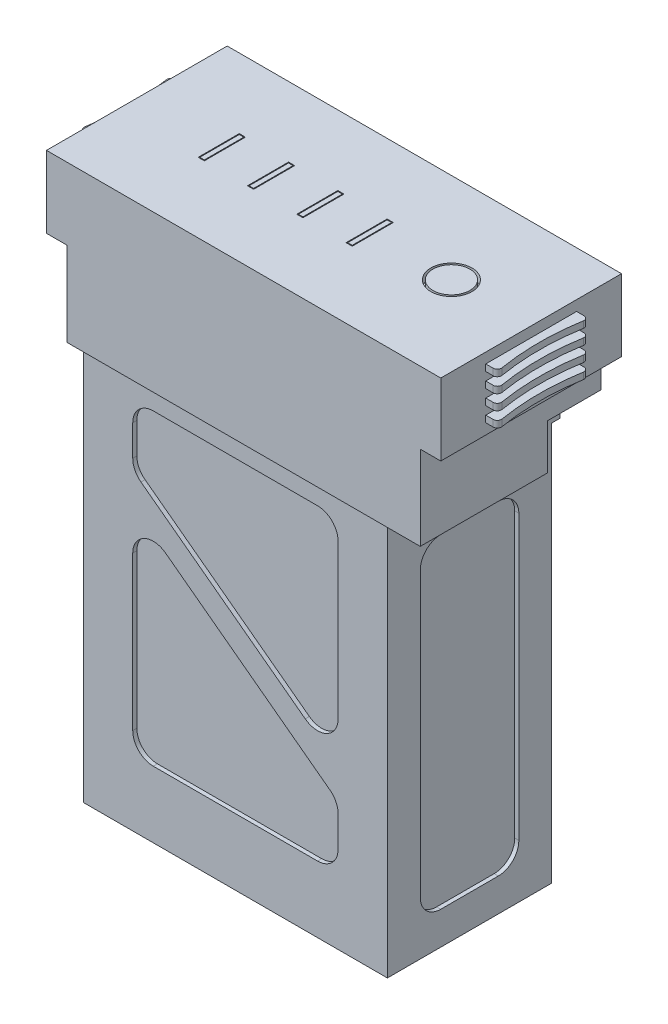
from build123d import *

# Parameters (mm, degrees)
SKETCH_1_W             = 74
SKETCH_1_H             = 40
EXTRUDE_1_DEPTH        = 97
SKETCH_2_W             = 96
SKETCH_2_H             = 44
EXTRUDE_2_DEPTH        = 38
SKETCH_3_W             = 10
SKETCH_3_H             = 13
CUT_EXTRUDE_1_DEPTH    = 11
SKETCH_4_W             = 5
SKETCH_4_H             = 44
CUT_EXTRUDE_2_DEPTH    = 11
SKETCH_5_R             = 5
SKETCH_5_W             = 1.5
SKETCH_5_H             = 10
CUT_EXTRUDE_3_DEPTH    = 2
SKETCH_6_R             = 4.5
SKETCH_6_W             = 1.1
SKETCH_6_H             = 9.6
EXTRUDE_3_DEPTH        = 2
EXTRUDE_4_DEPTH        = 1.6
PATTERN_LINEAR_1_COUNT = 4
PATTERN_LINEAR_1_PITCH = 3.6
MIRROR_2_COPY_1_DEPTH  = 1.6
MIRROR_2_COPY_2_DEPTH  = 1.6
MIRROR_2_COPY_3_DEPTH  = 1.6
CUT_EXTRUDE_4_DEPTH    = 1
CUT_EXTRUDE_5_DEPTH    = 1
SKETCH_10_W            = 5
SKETCH_10_H            = 20.5
SKETCH_10_H_2          = 9.5
CUT_EXTRUDE_6_DEPTH    = 153.199942279


with BuildPart() as part:
    # 草图1 → 凸台-拉伸1 (new body)
    with BuildSketch(Plane(origin=(0, 0, 0), x_dir=(1, 0, 0), z_dir=(0, 1, 0))):
        Rectangle(SKETCH_1_W, SKETCH_1_H)
    extrude(amount=EXTRUDE_1_DEPTH)

    # 草图2 → 凸台-拉伸2 (add)
    with BuildSketch(Plane(origin=(0, 97, 0), x_dir=(1, 0, 0), z_dir=(0, 1, 0))):
        with Locations((4, 0)):
            Rectangle(SKETCH_2_W, SKETCH_2_H)
    extrude(amount=EXTRUDE_2_DEPTH)

    # 草图3 → 切除-拉伸1 (cut)
    with BuildSketch(Plane.XZ.offset(-97)):
        with Locations((42, -15.5)):
            Rectangle(SKETCH_3_W, SKETCH_3_H)
    extrude(amount=-CUT_EXTRUDE_1_DEPTH, mode=Mode.SUBTRACT)

    # 草图4 → 切除-拉伸2 (cut)
    with BuildSketch(Plane.XZ.offset(-97)):
        with Locations((49.5, 0)):
            Rectangle(SKETCH_4_W, SKETCH_4_H)
    extrude(amount=-CUT_EXTRUDE_2_DEPTH, mode=Mode.SUBTRACT)

    # 草图5 → 切除-拉伸3 (cut)
    with BuildSketch(Plane(origin=(0, 135, 0), x_dir=(1, 0, 0), z_dir=(0, 1, 0))):
        with Locations(Location((32.584956569, 0, 0), (0, 0, 270))):
            Circle(SKETCH_5_R)
        with Locations((12.683099686, 0)):
            Rectangle(SKETCH_5_W, SKETCH_5_H)
        with Locations((0.683099686, 0)):
            Rectangle(SKETCH_5_W, SKETCH_5_H)
        with Locations((-11.316900314, 0)):
            Rectangle(SKETCH_5_W, SKETCH_5_H)
        with Locations((-23.316900314, 0)):
            Rectangle(SKETCH_5_W, SKETCH_5_H)
    extrude(amount=-CUT_EXTRUDE_3_DEPTH, mode=Mode.SUBTRACT)

    # 草图6 → 凸台-拉伸3 (add)
    with BuildSketch(Plane(origin=(0, 133, 0), x_dir=(1, 0, 0), z_dir=(0, 1, 0))):
        with Locations(Location((32.584956569, 0, 0), (0, 0, 270))):
            Circle(SKETCH_6_R)
        with Locations((-23.316900314, 0)):
            Rectangle(SKETCH_6_W, SKETCH_6_H)
        with Locations((-11.316900314, 0)):
            Rectangle(SKETCH_6_W, SKETCH_6_H)
        with Locations((0.683099686, 0)):
            Rectangle(SKETCH_6_W, SKETCH_6_H)
        with Locations((12.683099686, 0)):
            Rectangle(SKETCH_6_W, SKETCH_6_H)
    extrude(amount=EXTRUDE_3_DEPTH)

    # 草图7 → 凸台-拉伸4 (add)
    with BuildSketch(Plane(origin=(0, 132.5, 0), x_dir=(1, 0, 0), z_dir=(0, 1, 0))):
        with BuildLine():
            Line((-44, -11.057288531), (-45.807138492, -11.057288531))
            ThreePointArc((-45.807138492, -11.057288531), (-46.570313957, -10.703479841), (-46.793453199, -9.892414949))
            ThreePointArc((-46.793453199, -9.892414949), (-45.972335636, 0), (-46.793453199, 9.892414949))
            ThreePointArc((-46.793453199, 9.892414949), (-46.570313957, 10.703479841), (-45.807138492, 11.057288531))
            Line((-45.807138492, 11.057288531), (-44, 11.057288531))
            Line((-44, 11.057288531), (-44, -11.057288531))
        make_face()
    extrude_4 = extrude(amount=-EXTRUDE_4_DEPTH)

    # 阵列(线性)1: 凸台-拉伸4 ×4
    with Locations(*[(0, -i * PATTERN_LINEAR_1_PITCH, 0) for i in range(1, PATTERN_LINEAR_1_COUNT)]):
        add(extrude_4)

    # 镜向2: 凸台-拉伸4 across plane
    add(extrude_4.mirror(Plane.ZY.offset(-4)))

    # 镜向2 copy 1 sketch → 镜向2 copy 1 (add)
    with BuildSketch(Plane(origin=(8, 128.9, 0), x_dir=(-1, 0, 0), z_dir=(0, 1, 0))):
        with BuildLine():
            Line((-44, 11.057288531), (-45.807138492, 11.057288531))
            ThreePointArc((-45.807138492, 11.057288531), (-46.570313957, 10.703479841), (-46.793453199, 9.892414949))
            ThreePointArc((-46.793453199, 9.892414949), (-45.972335636, 0), (-46.793453199, -9.892414949))
            ThreePointArc((-46.793453199, -9.892414949), (-46.570313957, -10.703479841), (-45.807138492, -11.057288531))
            Line((-45.807138492, -11.057288531), (-44, -11.057288531))
            Line((-44, -11.057288531), (-44, 11.057288531))
        make_face()
    extrude(amount=-MIRROR_2_COPY_1_DEPTH)

    # 镜向2 copy 2 sketch → 镜向2 copy 2 (add)
    with BuildSketch(Plane(origin=(8, 125.3, 0), x_dir=(-1, 0, 0), z_dir=(0, 1, 0))):
        with BuildLine():
            Line((-44, 11.057288531), (-45.807138492, 11.057288531))
            ThreePointArc((-45.807138492, 11.057288531), (-46.570313957, 10.703479841), (-46.793453199, 9.892414949))
            ThreePointArc((-46.793453199, 9.892414949), (-45.972335636, 0), (-46.793453199, -9.892414949))
            ThreePointArc((-46.793453199, -9.892414949), (-46.570313957, -10.703479841), (-45.807138492, -11.057288531))
            Line((-45.807138492, -11.057288531), (-44, -11.057288531))
            Line((-44, -11.057288531), (-44, 11.057288531))
        make_face()
    extrude(amount=-MIRROR_2_COPY_2_DEPTH)

    # 镜向2 copy 3 sketch → 镜向2 copy 3 (add)
    with BuildSketch(Plane(origin=(8, 121.7, 0), x_dir=(-1, 0, 0), z_dir=(0, 1, 0))):
        with BuildLine():
            Line((-44, 11.057288531), (-45.807138492, 11.057288531))
            ThreePointArc((-45.807138492, 11.057288531), (-46.570313957, 10.703479841), (-46.793453199, 9.892414949))
            ThreePointArc((-46.793453199, 9.892414949), (-45.972335636, 0), (-46.793453199, -9.892414949))
            ThreePointArc((-46.793453199, -9.892414949), (-46.570313957, -10.703479841), (-45.807138492, -11.057288531))
            Line((-45.807138492, -11.057288531), (-44, -11.057288531))
            Line((-44, -11.057288531), (-44, 11.057288531))
        make_face()
    extrude(amount=-MIRROR_2_COPY_3_DEPTH)

    # 草图8 → 切除-拉伸4 (cut)
    with BuildSketch(Plane.ZY.offset(37)):
        with BuildLine():
            Line((-7, 87), (7, 87))
            ThreePointArc((7, 87), (10.535533906, 85.535533906), (12, 82))
            Line((12, 82), (12, 13))
            ThreePointArc((12, 13), (10.535533906, 9.464466094), (7, 8))
            Line((7, 8), (-7, 8))
            ThreePointArc((-7, 8), (-10.535533906, 9.464466094), (-12, 13))
            Line((-12, 13), (-12, 82))
            ThreePointArc((-12, 82), (-10.535533906, 85.535533906), (-7, 87))
        make_face()
    cut_extrude_4 = extrude(amount=-CUT_EXTRUDE_4_DEPTH, mode=Mode.SUBTRACT)

    # 镜向3: 切除-拉伸4 across plane
    add(cut_extrude_4.mirror(Plane(origin=(0, 0, 0), x_dir=(0, 0, 1), z_dir=(1, 0, 0))), mode=Mode.SUBTRACT)

    # 草图9 → 切除-拉伸5 (cut)
    with BuildSketch(Plane(origin=(0, 0, -20), x_dir=(-1, 0, 0), z_dir=(0, 0, -1))):
        with BuildLine():
            Line((-20, 91.06721858), (20, 91.06721858))
            ThreePointArc((20, 91.06721858), (23.535533906, 89.602752486), (25, 86.06721858))
            Line((25, 86.06721858), (25, 78.57061248))
            ThreePointArc((25, 78.57061248), (24.470921387, 76.332117014), (22.995655219, 74.567357579))
            Line((22.995655219, 74.567357579), (-17.004344781, 44.635161975))
            ThreePointArc((-17.004344781, 44.635161975), (-22.238495466, 44.167495489), (-25, 48.638416876))
            Line((-25, 48.638416876), (-25, 86.06721858))
            ThreePointArc((-25, 86.06721858), (-23.535533906, 89.602752486), (-20, 91.06721858))
        make_face()
        with BuildLine():
            Line((-22.995655219, 32.657933054), (17.004344781, 62.590128658))
            ThreePointArc((17.004344781, 62.590128658), (22.238495466, 63.057795143), (25, 58.586873756))
            Line((25, 58.586873756), (25, 21.158072053))
            ThreePointArc((25, 21.158072053), (23.535533906, 17.622538147), (20, 16.158072053))
            Line((20, 16.158072053), (-20, 16.158072053))
            ThreePointArc((-20, 16.158072053), (-23.535533906, 17.622538147), (-25, 21.158072053))
            Line((-25, 21.158072053), (-25, 28.654678152))
            ThreePointArc((-25, 28.654678152), (-24.470921387, 30.893173618), (-22.995655219, 32.657933054))
        make_face()
    cut_extrude_5 = extrude(amount=-CUT_EXTRUDE_5_DEPTH, mode=Mode.SUBTRACT)

    # 镜向4: 切除-拉伸5 across plane
    add(cut_extrude_5.mirror(Plane.XY), mode=Mode.SUBTRACT)

    # 草图10 → 切除-拉伸6 (cut, through all)
    with BuildSketch(Plane(origin=(0, 0, -22), x_dir=(-1, 0, 0), z_dir=(0, 0, -1))):
        with Locations((41.5, 107.25)):
            Rectangle(SKETCH_10_W, SKETCH_10_H)
        with Locations((-49.5, 112.75)):
            Rectangle(SKETCH_10_W, SKETCH_10_H_2)
    extrude(amount=-CUT_EXTRUDE_6_DEPTH, mode=Mode.SUBTRACT)


solid = part.part
